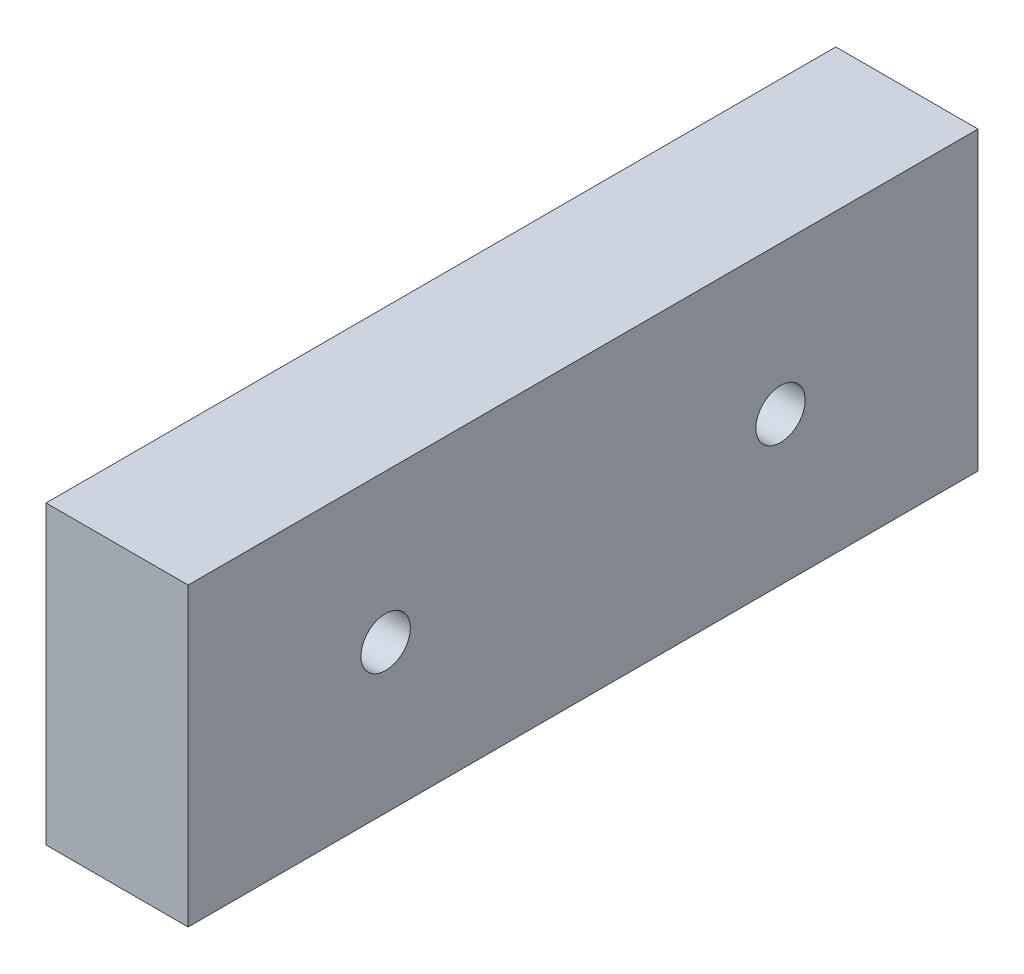
from build123d import *

# Parameters (mm, degrees)
SKETCH1_W           = 101.6
SKETCH1_H           = 38.1
SKETCH1_R           = 3.175
BOSS_EXTRUDE1_DEPTH = 18.288


with BuildPart() as part:
    # Sketch1 → Boss-Extrude1 (new body)
    with BuildSketch(Plane(origin=(0, 0, 0), x_dir=(0, 0, -1), z_dir=(1, 0, 0))):
        Rectangle(SKETCH1_W, SKETCH1_H)
        with Locations((-25.4, 0)):
            Circle(SKETCH1_R, mode=Mode.SUBTRACT)
        with Locations((25.4, 0)):
            Circle(SKETCH1_R, mode=Mode.SUBTRACT)
    extrude(amount=BOSS_EXTRUDE1_DEPTH)


solid = part.part
